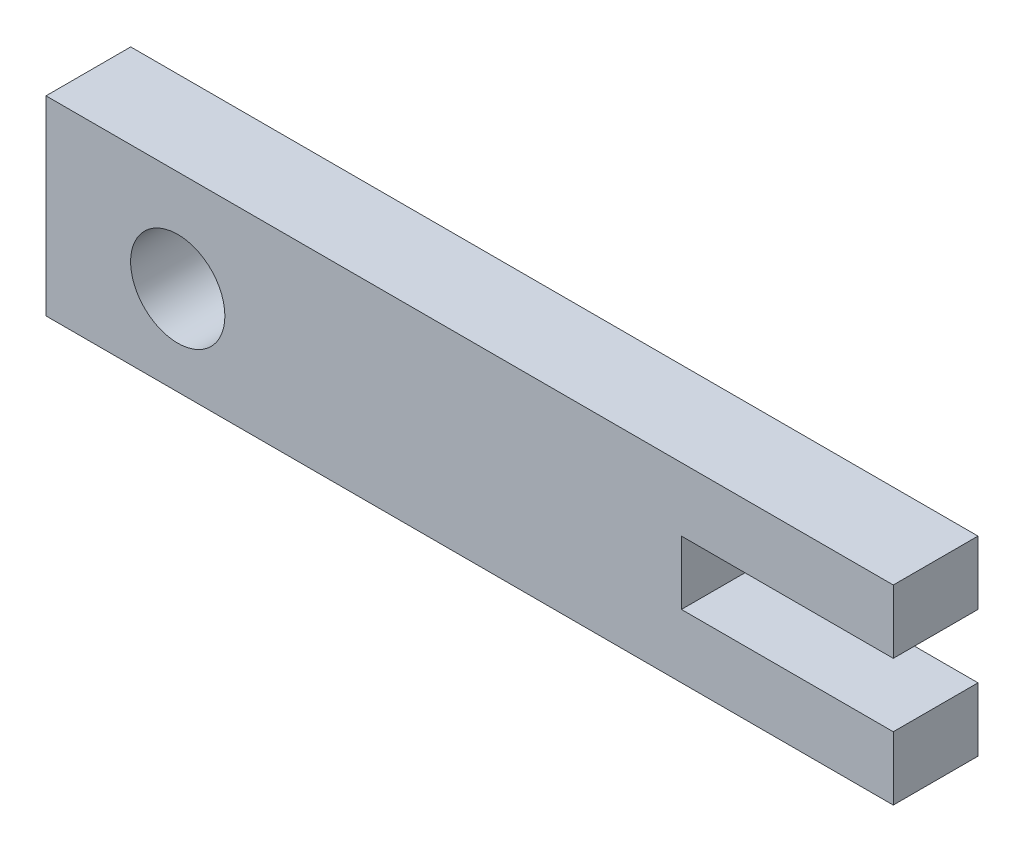
from build123d import *

# Parameters (mm, degrees)
CROQUIS1_W              = 350
CROQUIS1_H              = 20
SALIENTE_EXTRUIR1_DEPTH = 45
CROQUIS2_R              = 11.125
CORTAR_EXTRUIR1_DEPTH   = 182.796589627
CROQUIS3_R              = 11.125
CORTAR_EXTRUIR2_DEPTH   = 182.796589627


with BuildPart() as part:
    # Croquis1 → Saliente-Extruir1 (new body)
    with BuildSketch(Plane(origin=(0, 0, 0), x_dir=(1, 0, 0), z_dir=(0, 1, 0))):
        Rectangle(CROQUIS1_W, CROQUIS1_H)
    extrude(amount=SALIENTE_EXTRUIR1_DEPTH)

    # Croquis2 → Cortar-Extruir1 (cut, through all)
    with BuildSketch(Plane(origin=(0, 0, -10), x_dir=(-1, 0, 0), z_dir=(0, 0, -1))):
        with Locations((-143.9, 21.1)):
            Circle(CROQUIS2_R)
    cortar_extruir1 = extrude(amount=-CORTAR_EXTRUIR1_DEPTH, mode=Mode.SUBTRACT)

    # Simetría1: Cortar-Extruir1 across plane
    add(cortar_extruir1.mirror(Plane(origin=(0, 0, 0), x_dir=(0, 0, 1), z_dir=(1, 0, 0))), mode=Mode.SUBTRACT)

    # Croquis3 → Cortar-Extruir2 (cut, through all)
    with BuildSketch(Plane.XY.offset(10)):
        Polygon((25, 15), (25, 0), (175, 0), (175, 45), (25, 45), (25, 30), (-25, 30), (-25, 15), align=None)
        with Locations((143.9, 21.1)):
            Circle(CROQUIS3_R, mode=Mode.SUBTRACT)
    extrude(amount=-CORTAR_EXTRUIR2_DEPTH, mode=Mode.SUBTRACT)


solid = part.part
